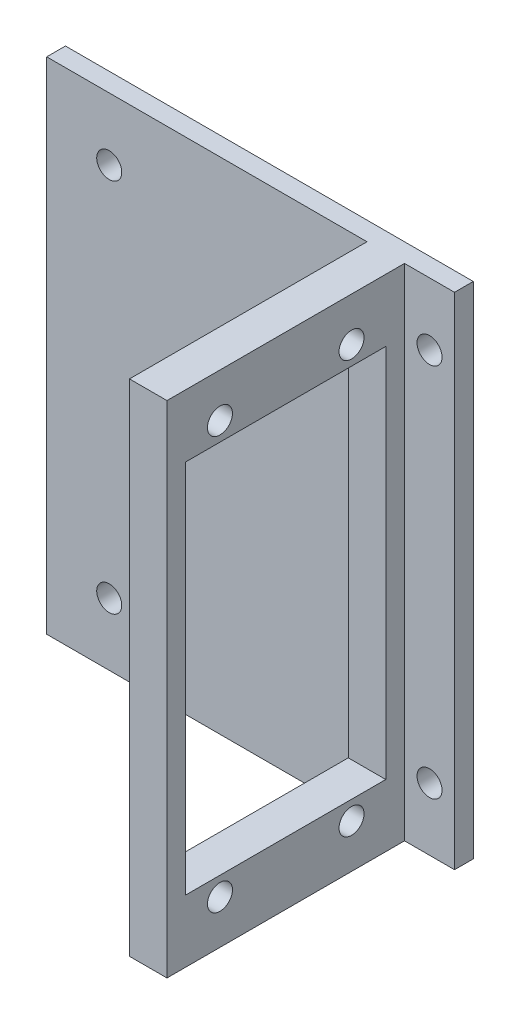
from build123d import *

# Parameters (mm, degrees)
CROQUIS2_W                 = 34.5
CROQUIS2_H                 = 80
SALIENTE_EXTRUIR2_DEPTH    = 3
CROQUIS3_W                 = 6
CROQUIS3_H                 = 80
SALIENTE_EXTRUIR3_DEPTH    = 38
CORTAR_EXTRUIR3_DEPTH      = 64.112993908
CORTAR_EXTRUIR3_DEPTH_BACK = 64.112993908
CROQUIS7_W                 = 32
CROQUIS7_H                 = 60
CROQUIS5_R                 = 2
CORTAR_EXTRUIR2_DEPTH      = 61.837899372
CROQUIS8_W                 = 3
CROQUIS8_H                 = 80
SALIENTE_EXTRUIR5_DEPTH    = 30.74
CROQUIS9_R                 = 2
CORTAR_EXTRUIR4_DEPTH      = 30.74
CROQUIS10_R                = 2
CORTAR_EXTRUIR5_DEPTH      = 194


with BuildPart() as part:
    # Croquis2 → Saliente-Extruir2 (new body)
    with BuildSketch(Plane.XY):
        Rectangle(CROQUIS2_W, CROQUIS2_H)
    extrude(amount=SALIENTE_EXTRUIR2_DEPTH)

    # Croquis3 → Saliente-Extruir3 (add)
    with BuildSketch(Plane.XY.offset(3)):
        with Locations((6.25, 0)):
            Rectangle(CROQUIS3_W, CROQUIS3_H)
    extrude(amount=SALIENTE_EXTRUIR3_DEPTH)

    # Croquis7 → Cortar-Extruir3 (cut, two sides: drawn at the far end of the back side and taken through both)
    with BuildSketch(Plane(origin=(9.25, 0, 0), x_dir=(0, 0, -1), z_dir=(1, 0, 0)).offset(-CORTAR_EXTRUIR3_DEPTH_BACK)):
        with Locations((-22, 0)):
            Rectangle(CROQUIS7_W, CROQUIS7_H)
    extrude(amount=CORTAR_EXTRUIR3_DEPTH + CORTAR_EXTRUIR3_DEPTH_BACK, mode=Mode.SUBTRACT)

    # Croquis5 → Cortar-Extruir2 (cut, through all)
    with BuildSketch(Plane.ZY.offset(-3.25)):
        with Locations((11.475, 33)):
            Circle(CROQUIS5_R)
        with Locations((32.525, 33)):
            Circle(CROQUIS5_R)
        with Locations(Location((32.525, -33, 0), (0, 0, 270))):
            Circle(CROQUIS5_R)
        with Locations(Location((11.475, -33, 0), (0, 0, 270))):
            Circle(CROQUIS5_R)
    extrude(amount=-CORTAR_EXTRUIR2_DEPTH, mode=Mode.SUBTRACT)

    # Croquis8 → Saliente-Extruir5 (add)
    with BuildSketch(Plane(origin=(-17.25, -40, 0), x_dir=(0, 0, -1), z_dir=(1, 0, 0))):
        with Locations((-1.5, 40)):
            Rectangle(CROQUIS8_W, CROQUIS8_H)
    extrude(amount=-SALIENTE_EXTRUIR5_DEPTH)

    # Croquis9 → Cortar-Extruir4 (cut)
    with BuildSketch(Plane.XY.offset(3)):
        with Locations((-37.99, 30)):
            Circle(CROQUIS9_R)
        with Locations((-37.99, -30)):
            Circle(CROQUIS9_R)
    extrude(amount=-CORTAR_EXTRUIR4_DEPTH, mode=Mode.SUBTRACT)

    # Croquis10 → Cortar-Extruir5 (cut)
    with BuildSketch(Plane.XY.offset(3)):
        with Locations((13.25, 30)):
            Circle(CROQUIS10_R)
        with Locations((13.25, -30)):
            Circle(CROQUIS10_R)
    extrude(amount=-CORTAR_EXTRUIR5_DEPTH, mode=Mode.SUBTRACT)


solid = part.part
